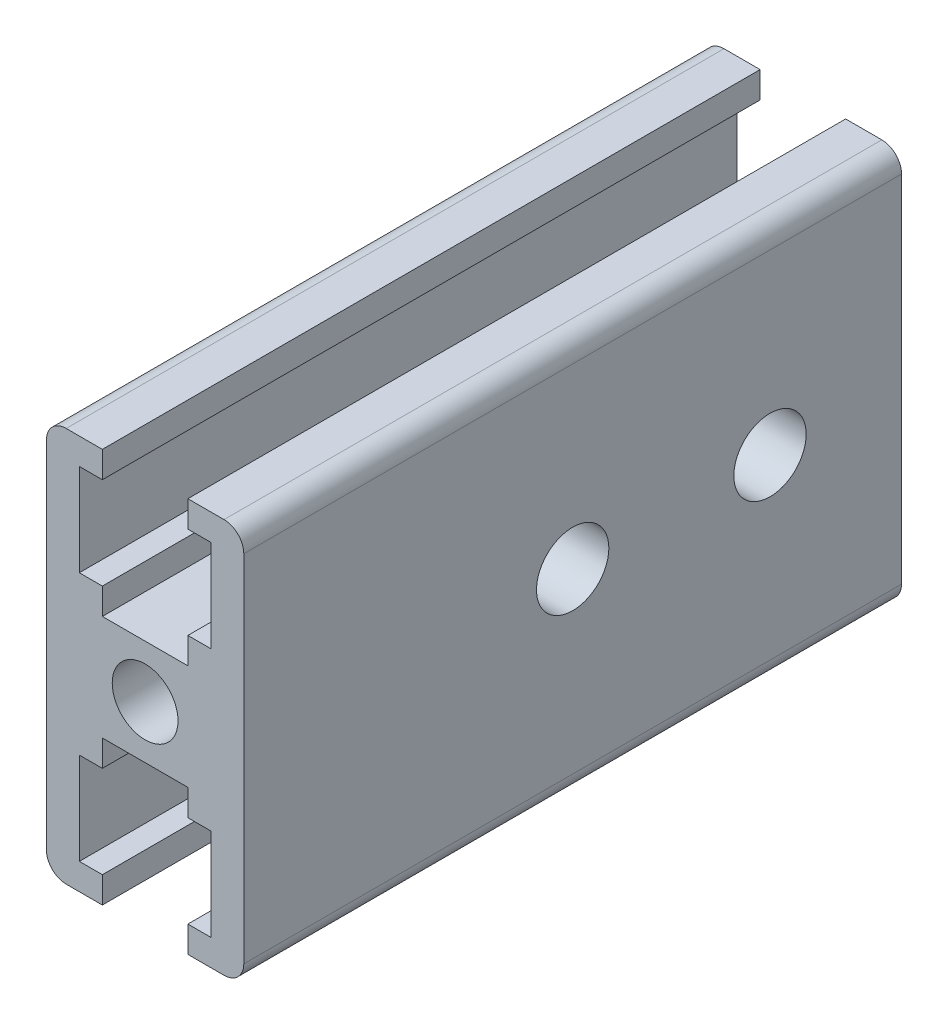
from build123d import *

# Parameters (mm, degrees)
SKETCH1_R               = 2.5
EXTRUDE_1_DEPTH         = 50
HOLE_WIZARD_5_5_5_5_1_D = 5.5
HOLE_WIZARD_5_5_5_5_2_D = 5.5


with BuildPart() as part:
    # Sketch1 → 凸台-拉伸1 (new body)
    with BuildSketch(Plane.XY):
        with BuildLine():
            Line((-6, -15), (-3.25, -15))
            Line((-3.25, -15), (-3.25, -13))
            Line((-3.25, -13), (-5, -13))
            Line((-5, -13), (-5, -6))
            Line((-5, -6), (-3.25, -6))
            Line((-3.25, -6), (-3.25, -4))
            Line((-3.25, -4), (3.25, -4))
            Line((3.25, -4), (3.25, -6))
            Line((3.25, -6), (5, -6))
            Line((5, -6), (5, -13))
            Line((5, -13), (3.25, -13))
            Line((3.25, -13), (3.25, -15))
            Line((3.25, -15), (6, -15))
            ThreePointArc((6, -15), (7.060660172, -14.560660172), (7.5, -13.5))
            Line((7.5, -13.5), (7.5, 13.5))
            ThreePointArc((7.5, 13.5), (7.060660172, 14.560660172), (6, 15))
            Line((6, 15), (3.25, 15))
            Line((3.25, 15), (3.25, 13))
            Line((3.25, 13), (5, 13))
            Line((5, 13), (5, 6))
            Line((5, 6), (3.25, 6))
            Line((3.25, 6), (3.25, 4))
            Line((3.25, 4), (-3.25, 4))
            Line((-3.25, 4), (-3.25, 6))
            Line((-3.25, 6), (-5, 6))
            Line((-5, 6), (-5, 13))
            Line((-5, 13), (-3.25, 13))
            Line((-3.25, 13), (-3.25, 15))
            Line((-3.25, 15), (-6, 15))
            ThreePointArc((-6, 15), (-7.060660172, 14.560660172), (-7.5, 13.5))
            Line((-7.5, 13.5), (-7.5, -13.5))
            ThreePointArc((-7.5, -13.5), (-7.060660172, -14.560660172), (-6, -15))
        make_face()
        Circle(SKETCH1_R, mode=Mode.SUBTRACT)
    extrude(amount=EXTRUDE_1_DEPTH)

    # Ø5.5 (5.5) 直径孔1 (through all)
    with Locations(Plane(origin=(7.5, 0, 0), x_dir=(0, 0, -1), z_dir=(1, 0, 0))):
        with Locations((-25, 0)):
            Hole(HOLE_WIZARD_5_5_5_5_1_D / 2)

    # Ø5.5 (5.5) 直径孔2 (through all)
    with Locations(Plane(origin=(7.5, 0, 0), x_dir=(0, 0, -1), z_dir=(1, 0, 0))):
        with Locations((-10, 0)):
            Hole(HOLE_WIZARD_5_5_5_5_2_D / 2)

    # 草图6 → M6 螺纹孔1 (revolve, cut)
    with BuildSketch(Plane(origin=(0, 0, 50), x_dir=(0, -1, 0), z_dir=(1, 0, 0))):
        Polygon((0, 0), (0, 26.502151548), (2.5, 25), (2.5, 0), align=None)
    revolve(axis=Axis((0, 0, 56.35), (0, 0, -1)), mode=Mode.SUBTRACT)


solid = part.part
